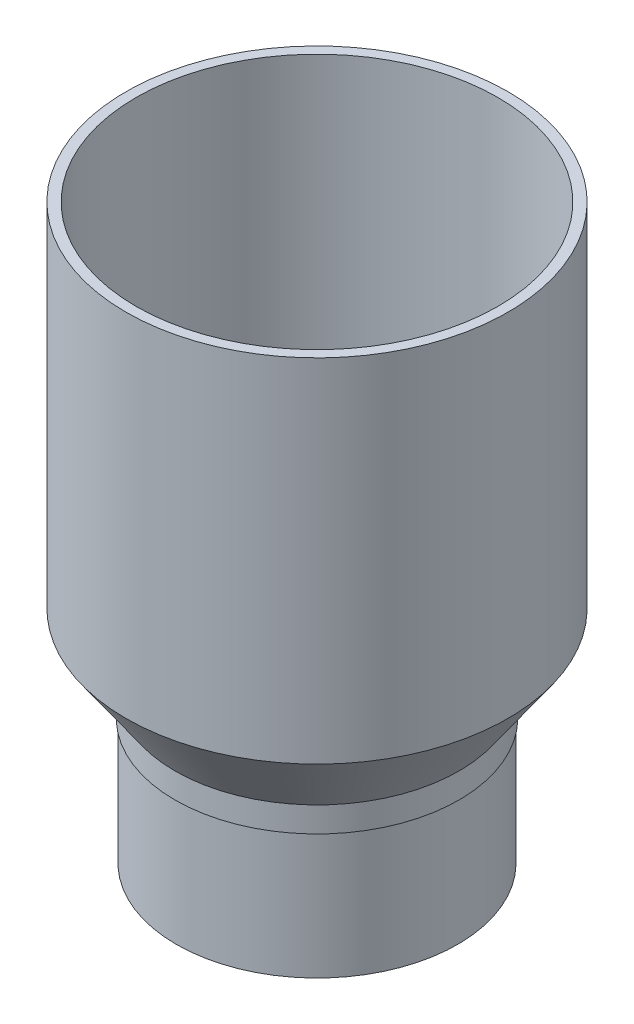
from build123d import *


with BuildPart() as part:
    # Sketch1 → Revolve1 (revolve)
    with BuildSketch(Plane.XY, mode=Mode.PRIVATE) as revolve1_sk:
        Polygon((36, 75.153790368), (36, 5.153790368), (26.249200582, -8.771794385), (26.249200582, -13.771794385), (26, -13.771794385), (26, -38.771794385), (28, -38.771794385), (28, -13.771794385), (28.249200582, -13.771794385), (28.249200582, -8.771794385), (38, 5.153790368), (38, 75.153790368), align=None)
    revolve(revolve1_sk.sketch.rotate(Axis((0, 88.774470053, 0), (0, -1, 0)), 90), axis=Axis((0, 88.774470053, 0), (0, -1, 0)))


solid = part.part
